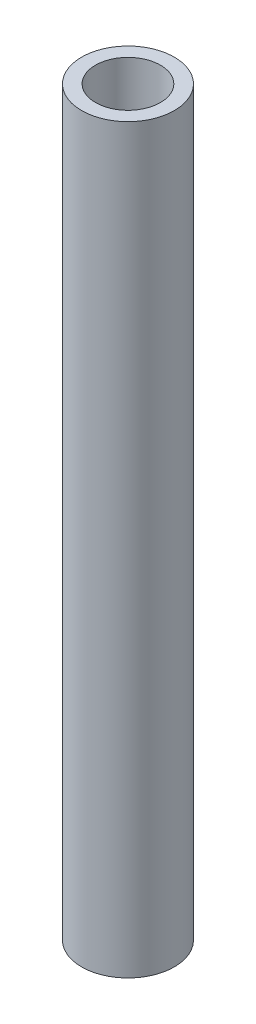
from build123d import *

# Parameters (mm, degrees)
SKETCH1_R           = 50
SKETCH1_R_2         = 35
BOSS_EXTRUDE1_DEPTH = 400


with BuildPart() as part:
    # Sketch1 → Boss-Extrude1 (new, symmetric)
    with BuildSketch(Plane(origin=(0, 0, 0), x_dir=(1, 0, 0), z_dir=(0, 1, 0))):
        with Locations(Location((0, 0, 0), (0, 0, 270))):
            Circle(SKETCH1_R)
        with Locations(Location((0, 0, 0), (0, 0, 270))):
            Circle(SKETCH1_R_2, mode=Mode.SUBTRACT)
    extrude(amount=BOSS_EXTRUDE1_DEPTH, both=True)


solid = part.part
